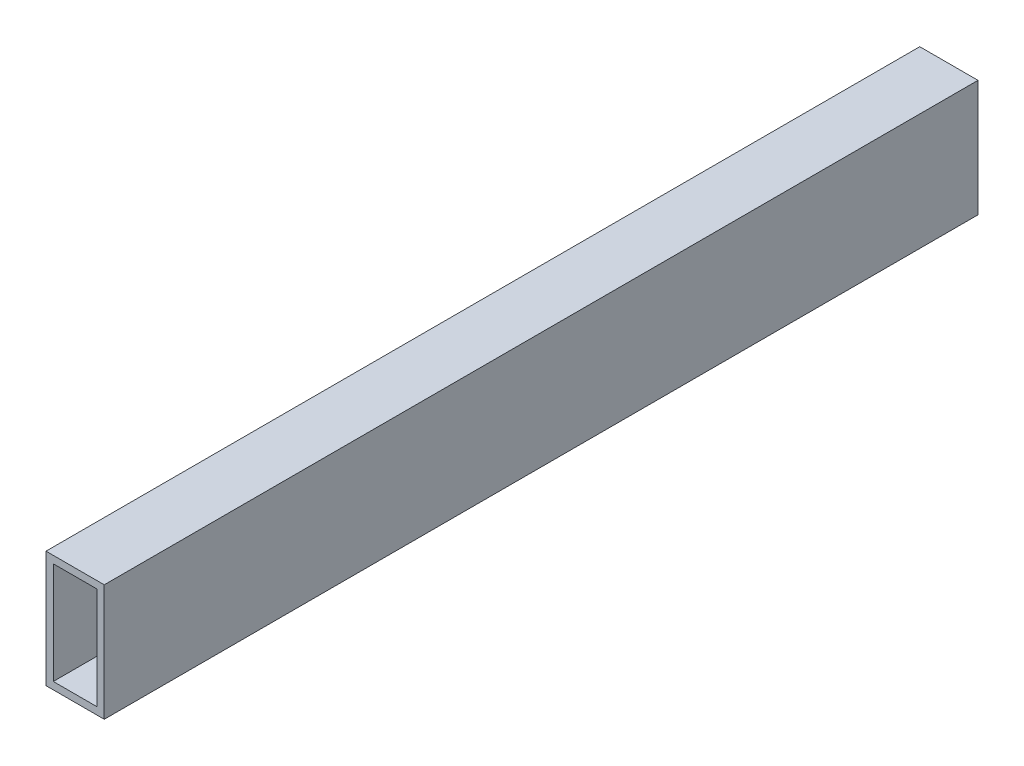
from build123d import *

# Parameters (mm, degrees)
SKETCH2_W           = 25.4
SKETCH2_H           = 50.8
SKETCH2_W_2         = 19.05
SKETCH2_H_2         = 44.45
BOSS_EXTRUDE1_DEPTH = 190.5


with BuildPart() as part:
    # Sketch2 → Boss-Extrude1 (new, symmetric)
    with BuildSketch(Plane.XY):
        Rectangle(SKETCH2_W, SKETCH2_H)
        Rectangle(SKETCH2_W_2, SKETCH2_H_2, mode=Mode.SUBTRACT)
    extrude(amount=BOSS_EXTRUDE1_DEPTH, both=True)


solid = part.part
